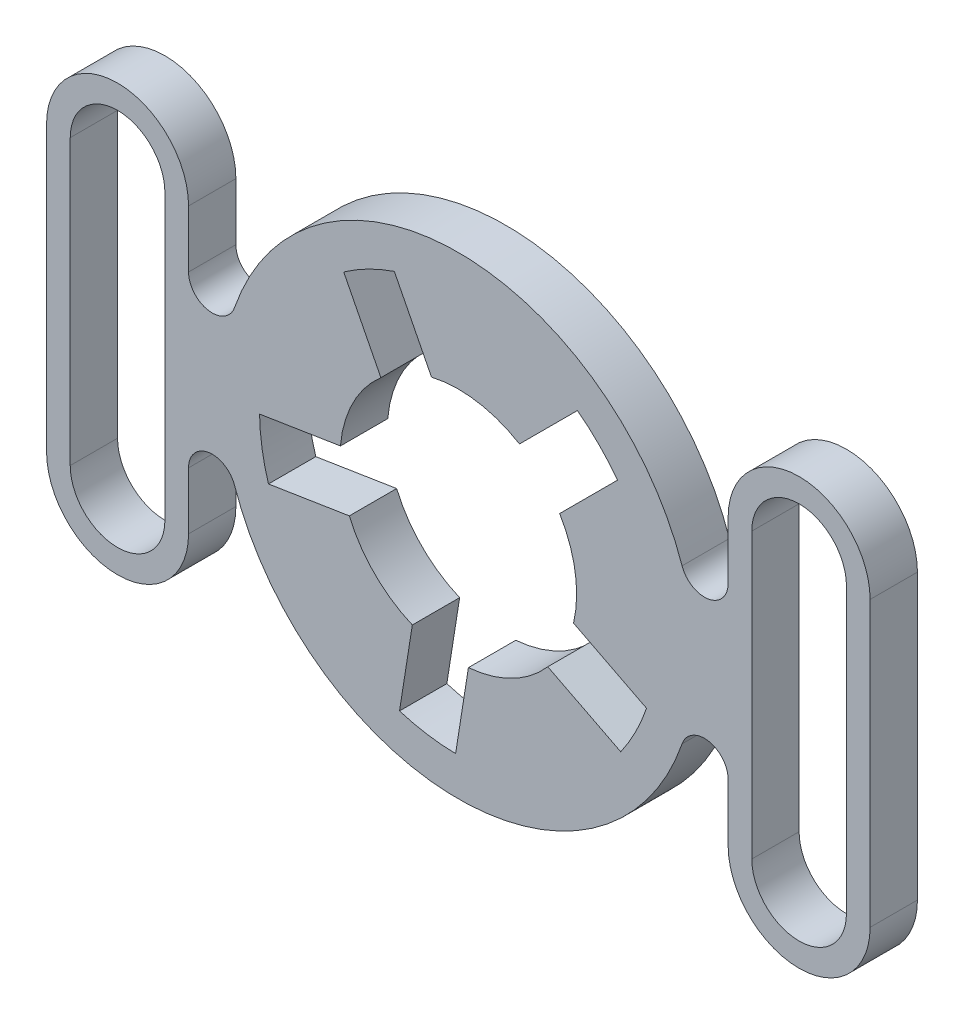
from build123d import *

# Parameters (mm, degrees)
BOSS_EXTRUDE1_DEPTH = 5


with BuildPart() as part:
    # Sketch2 → Boss-Extrude1 (new, symmetric)
    with BuildSketch(Plane.XY):
        with BuildLine():
            ThreePointArc((57, 17.916472867), (52.825722824, 12.985126011), (47.272727273, 16.287702607))
            ThreePointArc((47.272727273, 16.287702607), (0, 50), (-47.272727273, 16.287702607))
            ThreePointArc((-47.272727273, 16.287702607), (-52.825722824, 12.985126011), (-57, 17.916472867))
            Line((-57, 17.916472867), (-57, 30))
            ThreePointArc((-57, 30), (-72, 45), (-87, 30))
            Line((-87, 30), (-87, -30))
            ThreePointArc((-87, -30), (-72, -45), (-57, -30))
            Line((-57, -30), (-57, -17.916472867))
            ThreePointArc((-57, -17.916472867), (-52.825722824, -12.985126011), (-47.272727273, -16.287702607))
            ThreePointArc((-47.272727273, -16.287702607), (0, -50), (47.272727273, -16.287702607))
            ThreePointArc((47.272727273, -16.287702607), (52.825722824, -12.985126011), (57, -17.916472867))
            Line((57, -17.916472867), (57, -30))
            ThreePointArc((57, -30), (72, -45), (87, -30))
            Line((87, -30), (87, 30))
            ThreePointArc((87, 30), (72, 45), (57, 30))
            Line((57, 30), (57, 17.916472867))
        make_face()
        with BuildLine():
            Line((62, -30), (62, 30))
            ThreePointArc((62, 30), (72, 40), (82, 30))
            Line((82, 30), (82, -30))
            ThreePointArc((82, -30), (72, -40), (62, -30))
        make_face(mode=Mode.SUBTRACT)
        with BuildLine():
            ThreePointArc((-62, 30), (-72, 40), (-82, 30))
            Line((-82, 30), (-82, -30))
            ThreePointArc((-82, -30), (-72, -40), (-62, -30))
            Line((-62, -30), (-62, 30))
        make_face(mode=Mode.SUBTRACT)
        with BuildLine():
            ThreePointArc((24.348067415, -5.672002568), (24.692208515, 3.910861626), (21.403642989, 12.918361615))
            Line((21.403642989, 12.918361615), (33.636517601, 25.151236226))
            ThreePointArc((33.636517601, 25.151236226), (29.69848481, 29.69848481), (25.151236226, 33.636517601))
            Line((25.151236226, 33.636517601), (12.918361615, 21.403642989))
            ThreePointArc((12.918361615, 21.403642989), (3.910861626, 24.692208515), (-5.672002568, 24.348067415))
            Line((-5.672002568, 24.348067415), (-13.525991536, 39.762388673))
            ThreePointArc((-13.525991536, 39.762388673), (-19.067600989, 37.422274016), (-24.218069826, 34.314502676))
            Line((-24.218069826, 34.314502676), (-16.364080859, 18.900181419))
            ThreePointArc((-16.364080859, 18.900181419), (-22.275163105, 11.349762493), (-24.90913336, 2.129571608))
            Line((-24.90913336, 2.129571608), (-41.996040101, -0.576728553))
            ThreePointArc((-41.996040101, -0.576728553), (-41.482910305, -6.570247532), (-40.118826521, -12.42898864))
            Line((-40.118826521, -12.42898864), (-23.03191978, -9.722688479))
            ThreePointArc((-23.03191978, -9.722688479), (-17.67766953, -17.67766953), (-9.722688479, -23.03191978))
            Line((-9.722688479, -23.03191978), (-12.42898864, -40.118826521))
            ThreePointArc((-12.42898864, -40.118826521), (-6.570247532, -41.482910305), (-0.576728553, -41.996040101))
            Line((-0.576728553, -41.996040101), (2.129571608, -24.90913336))
            ThreePointArc((2.129571608, -24.90913336), (11.349762493, -22.275163105), (18.900181419, -16.364080859))
            Line((18.900181419, -16.364080859), (34.314502676, -24.218069826))
            ThreePointArc((34.314502676, -24.218069826), (37.422274016, -19.067600989), (39.762388673, -13.525991536))
            Line((39.762388673, -13.525991536), (24.348067415, -5.672002568))
        make_face(mode=Mode.SUBTRACT)
    extrude(amount=BOSS_EXTRUDE1_DEPTH, both=True)


solid = part.part
